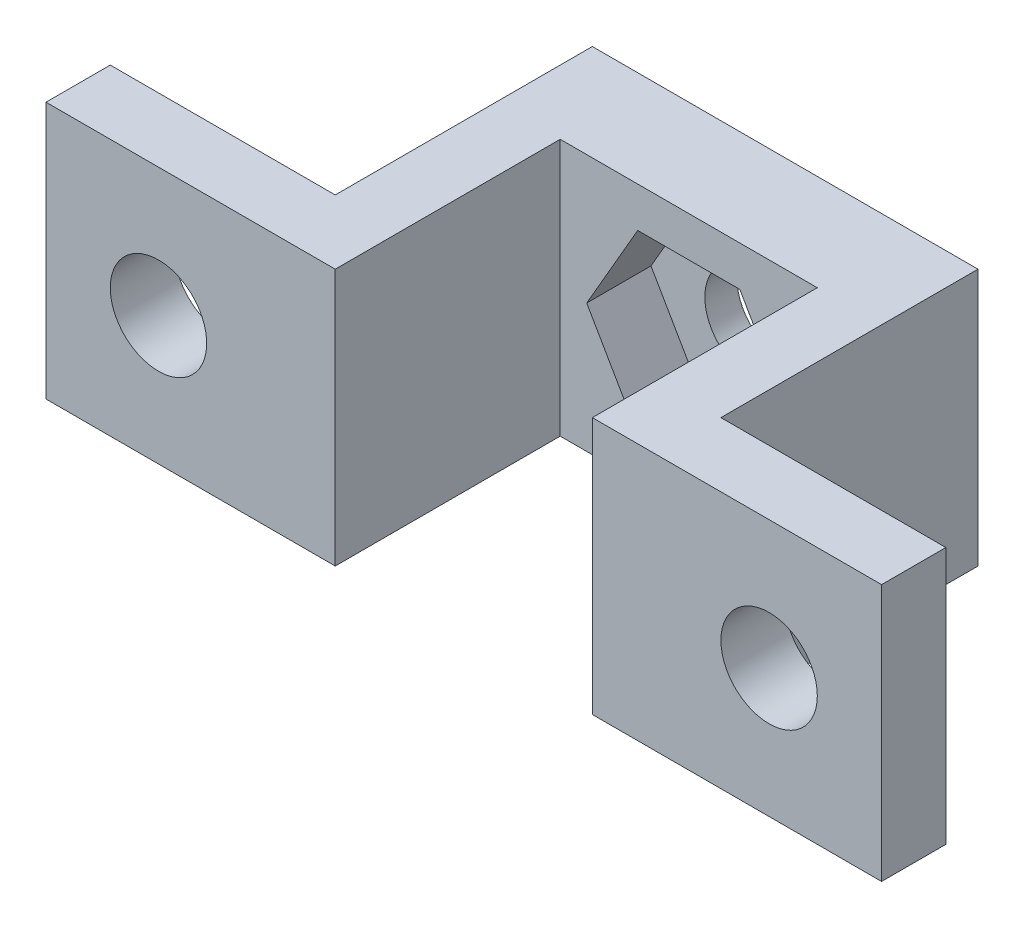
from build123d import *

# Parameters (mm, degrees)
IZIM1_W                          = 8
IZIM1_H                          = 8
Y_KSEKLIK_EKSTR_ZYON1_DEPTH      = 3
KES_EKSTR_ZYON1_DEPTH            = 2
Y_KSEKLIK_EKSTR_ZYON2_DEPTH      = 7
Y_KSEKLIK_EKSTR_ZYON2_DEPTH_BACK = 3
IZIM3_W                          = 2
IZIM3_H                          = 8
IZIM4_W                          = 7
IZIM4_H                          = 2
Y_KSEKLIK_EKSTR_ZYON3_DEPTH      = 8
IZIM5_R                          = 1.5
KES_EKSTR_ZYON2_DEPTH            = 7
IZIM7_R                          = 1.5
KES_EKSTR_ZYON3_DEPTH            = 7


with BuildPart() as part:
    # Çizim1 → Yükseklik-Ekstrüzyon1 (new body)
    with BuildSketch(Plane.XY):
        with Locations((4, 4)):
            Rectangle(IZIM1_W, IZIM1_H)
    extrude(amount=Y_KSEKLIK_EKSTR_ZYON1_DEPTH)

    # Çizim2 → Kes-Ekstrüzyon1 (cut)
    with BuildSketch(Plane.XY.offset(3)):
        Polygon((5.58771324, 6.75), (2.41228676, 6.75), (0.824573519, 4), (2.41228676, 1.25), (5.58771324, 1.25), (7.175426481, 4), align=None)
    extrude(amount=-KES_EKSTR_ZYON1_DEPTH, mode=Mode.SUBTRACT)

    # Çizim3 → Yükseklik-Ekstrüzyon2 (add, two sides: drawn at the far end of the back side and taken through both)
    with BuildSketch(Plane.XY.offset(3).offset(-Y_KSEKLIK_EKSTR_ZYON2_DEPTH_BACK)):
        with Locations((-1, 4)):
            Rectangle(IZIM3_W, IZIM3_H)
        with Locations((9, 4)):
            Rectangle(IZIM3_W, IZIM3_H)
    extrude(amount=Y_KSEKLIK_EKSTR_ZYON2_DEPTH + Y_KSEKLIK_EKSTR_ZYON2_DEPTH_BACK)

    # Çizim4 → Yükseklik-Ekstrüzyon3 (add)
    with BuildSketch(Plane(origin=(0, 8, 0), x_dir=(1, 0, 0), z_dir=(0, 1, 0))):
        with Locations((-5.5, -9)):
            Rectangle(IZIM4_W, IZIM4_H)
        with Locations((13.5, -9)):
            Rectangle(IZIM4_W, IZIM4_H)
    extrude(amount=-Y_KSEKLIK_EKSTR_ZYON3_DEPTH)

    # Çizim5 → Kes-Ekstrüzyon2 (cut)
    with BuildSketch(Plane.XY.offset(1)):
        with Locations((4, 4)):
            Circle(IZIM5_R)
    extrude(amount=-KES_EKSTR_ZYON2_DEPTH, mode=Mode.SUBTRACT)

    # Çizim7 → Kes-Ekstrüzyon3 (cut)
    with BuildSketch(Plane(origin=(0, 0, 8), x_dir=(-1, 0, 0), z_dir=(0, 0, -1))):
        with Locations((-13.5, 4)):
            Circle(IZIM7_R)
        with Locations((5.5, 4)):
            Circle(IZIM7_R)
    extrude(amount=-KES_EKSTR_ZYON3_DEPTH, mode=Mode.SUBTRACT)


solid = part.part
